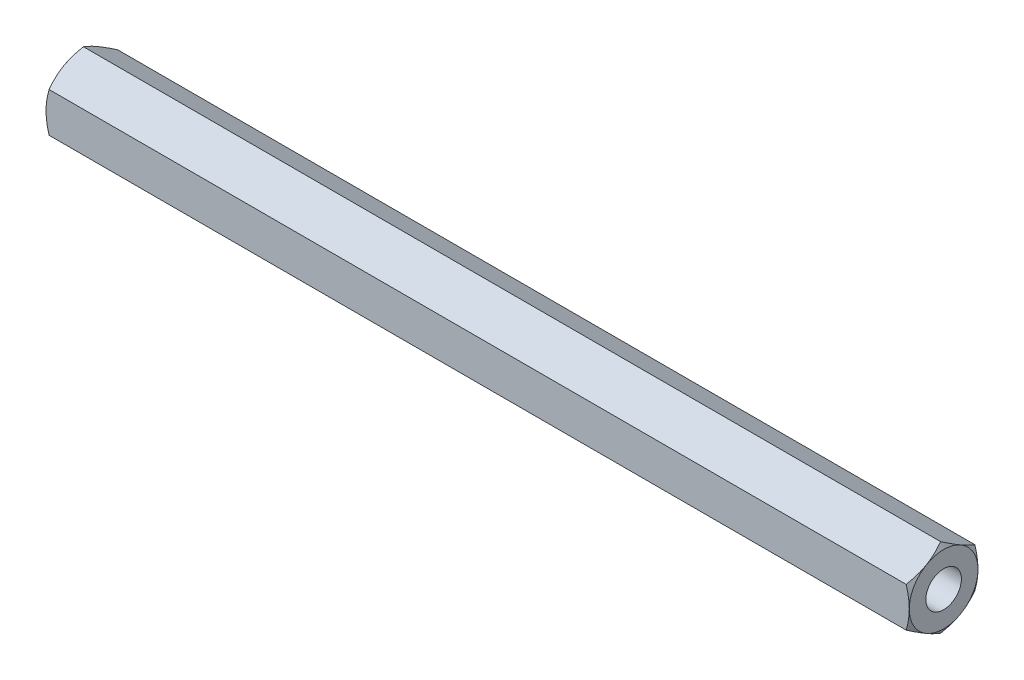
from build123d import *

# Parameters (mm, degrees)
BOSS_EXTRUDE1_DEPTH = 100.5
TAP1_D              = 4.134
TAP1_DEPTH          = 12.4
TAP1_TIP            = 1.2419789
TAP2_D              = 4.134
TAP2_DEPTH          = 12.4
TAP2_TIP            = 1.2419789


with BuildPart() as part:
    # Sketch1 → Boss-Extrude1 (new body)
    with BuildSketch(Plane(origin=(0, 0, 0), x_dir=(0, 0, -1), z_dir=(1, 0, 0))):
        Polygon((0, -4.618802154), (4, -2.309401077), (4, 2.309401077), (0, 4.618802154), (-4, 2.309401077), (-4, -2.309401077), align=None)
    extrude(amount=BOSS_EXTRUDE1_DEPTH)

    # Sketch2 → Cut-Revolve1 (revolve, cut)
    with BuildSketch(Plane.XY):
        Polygon((0, 4.618802154), (0.35726559, 4.618802154), (0, 4), align=None)
        Polygon((100.14273441, 4.618802154), (100.5, 4), (100.5, 4.618802154), align=None)
    revolve(axis=Axis((0, 0, 0), (1, 0, 0)), mode=Mode.SUBTRACT)

    # Tap1
    with Locations(Plane.ZY):
        with Locations((0, 0)):
            Hole(TAP1_D / 2, depth=TAP1_DEPTH)
            with Locations((0, 0, -(TAP1_DEPTH + TAP1_TIP / 2))):  # 118° drill point
                Cone(0, TAP1_D / 2, TAP1_TIP, mode=Mode.SUBTRACT)

    # Tap2
    with Locations(Plane(origin=(100.5, 0, 0), x_dir=(0, 0, -1), z_dir=(1, 0, 0))):
        with Locations((0, 0)):
            Hole(TAP2_D / 2, depth=TAP2_DEPTH)
            with Locations((0, 0, -(TAP2_DEPTH + TAP2_TIP / 2))):  # 118° drill point
                Cone(0, TAP2_D / 2, TAP2_TIP, mode=Mode.SUBTRACT)


solid = part.part
